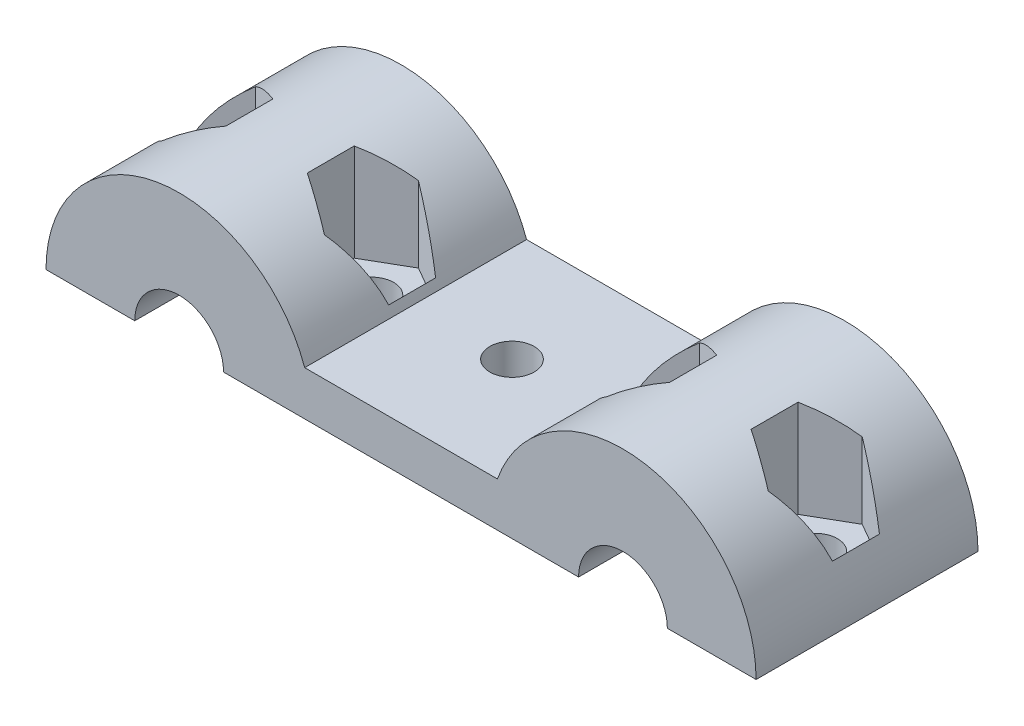
from build123d import *

# Parameters (mm, degrees)
BOSS_EXTRUDE1_DEPTH     = 15
CUT_EXTRUDE1_DEPTH      = 30
SKETCH3_R               = 1.5
CUT_EXTRUDE2_DEPTH      = 30
MIRROR2_COPY_1_DEPTH    = 30
MIRROR2_COPY_2_SKETCH_R = 1.5
MIRROR2_COPY_2_DEPTH    = 30
SKETCH4_R               = 1.5
CUT_EXTRUDE3_DEPTH      = 5


with BuildPart() as part:
    # Sketch1 → Boss-Extrude1 (new body)
    with BuildSketch(Plane.XY):
        with BuildLine():
            Line((12, 0), (-12, 0))
            ThreePointArc((-12, 0), (-15, 3), (-18, 0))
            Line((-18, 0), (-24, 0))
            ThreePointArc((-24, 0), (-16.521917809, 8.870387037), (-6.514718626, 3))
            Line((-6.514718626, 3), (6.514718626, 3))
            ThreePointArc((6.514718626, 3), (16.521917809, 8.870387037), (24, 0))
            Line((24, 0), (18, 0))
            ThreePointArc((18, 0), (15, 3), (12, 0))
        make_face()
    extrude(amount=BOSS_EXTRUDE1_DEPTH)

    # Sketch2 → Cut-Extrude1 (cut)
    with BuildSketch(Plane(origin=(0, 2, 0), x_dir=(-1, 0, 0), z_dir=(0, -1, 0))):
        Polygon((-20.5, -10.675426481), (-17.75, -9.08771324), (-17.75, -5.91228676), (-20.5, -4.324573519), (-23.25, -5.91228676), (-23.25, -9.08771324), align=None)
    cut_extrude1 = extrude(amount=-CUT_EXTRUDE1_DEPTH, mode=Mode.SUBTRACT)

    # Sketch3 → Cut-Extrude2 (cut)
    with BuildSketch(Plane(origin=(0, 2, 0), x_dir=(1, 0, 0), z_dir=(0, 1, 0))):
        with Locations((20.5, -7.5)):
            Circle(SKETCH3_R)
    cut_extrude2 = extrude(amount=-CUT_EXTRUDE2_DEPTH, mode=Mode.SUBTRACT)

    # Mirror1: Cut-Extrude1, Cut-Extrude2 across plane
    add(cut_extrude1.mirror(Plane.ZY.offset(-15)), mode=Mode.SUBTRACT)
    add(cut_extrude2.mirror(Plane.ZY.offset(-15)), mode=Mode.SUBTRACT)

    # Mirror2: Cut-Extrude1, Cut-Extrude2 across plane
    add(cut_extrude1.mirror(Plane(origin=(0, 0, 0), x_dir=(0, 0, 1), z_dir=(1, 0, 0))), mode=Mode.SUBTRACT)
    add(cut_extrude2.mirror(Plane(origin=(0, 0, 0), x_dir=(0, 0, 1), z_dir=(1, 0, 0))), mode=Mode.SUBTRACT)

    # Mirror2 copy 1 sketch → Mirror2 copy 1 (cut)
    with BuildSketch(Plane(origin=(-30, 2, 0), x_dir=(-1, 0, 0), z_dir=(0, -1, 0))):
        Polygon((-20.5, -10.675426481), (-17.75, -9.08771324), (-17.75, -5.91228676), (-20.5, -4.324573519), (-23.25, -5.91228676), (-23.25, -9.08771324), align=None)
    extrude(amount=-MIRROR2_COPY_1_DEPTH, mode=Mode.SUBTRACT)

    # Mirror2 copy 2 sketch → Mirror2 copy 2 (cut)
    with BuildSketch(Plane(origin=(-30, 2, 0), x_dir=(1, 0, 0), z_dir=(0, 1, 0))):
        with Locations((20.5, -7.5)):
            Circle(MIRROR2_COPY_2_SKETCH_R)
    extrude(amount=-MIRROR2_COPY_2_DEPTH, mode=Mode.SUBTRACT)

    # Sketch4 → Cut-Extrude3 (cut)
    with BuildSketch(Plane(origin=(0, 3, 0), x_dir=(1, 0, 0), z_dir=(0, 1, 0))):
        with Locations((0, -7.5)):
            Circle(SKETCH4_R)
    extrude(amount=-CUT_EXTRUDE3_DEPTH, mode=Mode.SUBTRACT)


solid = part.part
